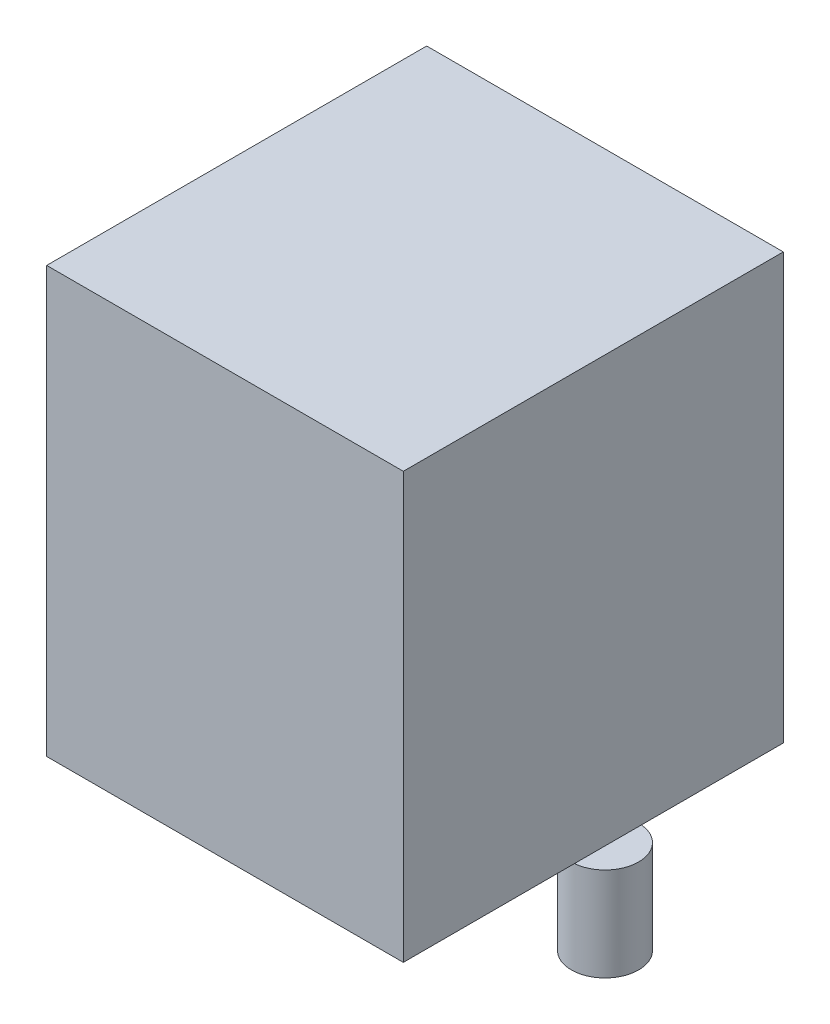
from build123d import *

# Parameters (mm, degrees)
BOSS_EXTRUDE1_DEPTH = 3.2
SKETCH1_3_W         = 12.2
SKETCH1_3_H         = 13
BOSS_EXTRUDE2_DEPTH = 14.55
CUT_EXTRUDE1_START  = -6
SKETCH2_W           = 9.87658836
SKETCH2_H           = 12.271413297
CUT_EXTRUDE1_DEPTH  = 2


with BuildPart() as part:
    # Sketch1 → Boss-Extrude1 (new body)
    with BuildSketch(Plane(origin=(0, 0, 0), x_dir=(1, 0, 0), z_dir=(0, 1, 0))):
        with BuildLine():
            ThreePointArc((-4.85, 0), (-5.222986487, 0.847791248), (-6.1, 1.145643924))
            Line((-6.1, 1.145643924), (-6.1, -1.145643924))
            ThreePointArc((-6.1, -1.145643924), (-5.222986487, -0.847791248), (-4.85, 0))
        make_face()
        with BuildLine():
            Line((-6.1, -1.145643924), (-6.1, 1.145643924))
            ThreePointArc((-6.1, 1.145643924), (-7.15, 0), (-6.1, -1.145643924))
        make_face()
        with BuildLine():
            ThreePointArc((7.15, 0), (6.847791248, 0.777013513), (6.1, 1.145643924))
            Line((6.1, 1.145643924), (6.1, -1.145643924))
            ThreePointArc((6.1, -1.145643924), (6.847791248, -0.777013513), (7.15, 0))
        make_face()
        with BuildLine():
            Line((6.1, -1.145643924), (6.1, 1.145643924))
            ThreePointArc((6.1, 1.145643924), (4.85, 0), (6.1, -1.145643924))
        make_face()
    extrude(amount=-BOSS_EXTRUDE1_DEPTH)

    # Sketch1<3> → Boss-Extrude2 (add)
    with BuildSketch(Plane(origin=(0, 0, 0), x_dir=(1, 0, 0), z_dir=(0, 1, 0))):
        with Locations((0, -0.5)):
            Rectangle(SKETCH1_3_W, SKETCH1_3_H)
    extrude(amount=BOSS_EXTRUDE2_DEPTH)

    # Sketch2 → Cut-Extrude1 (cut)
    with BuildSketch(Plane.XY.offset(CUT_EXTRUDE1_START)):
        with Locations((0, 7.301829354)):
            Rectangle(SKETCH2_W, SKETCH2_H)
    extrude(amount=CUT_EXTRUDE1_DEPTH, mode=Mode.SUBTRACT)


solid = part.part
